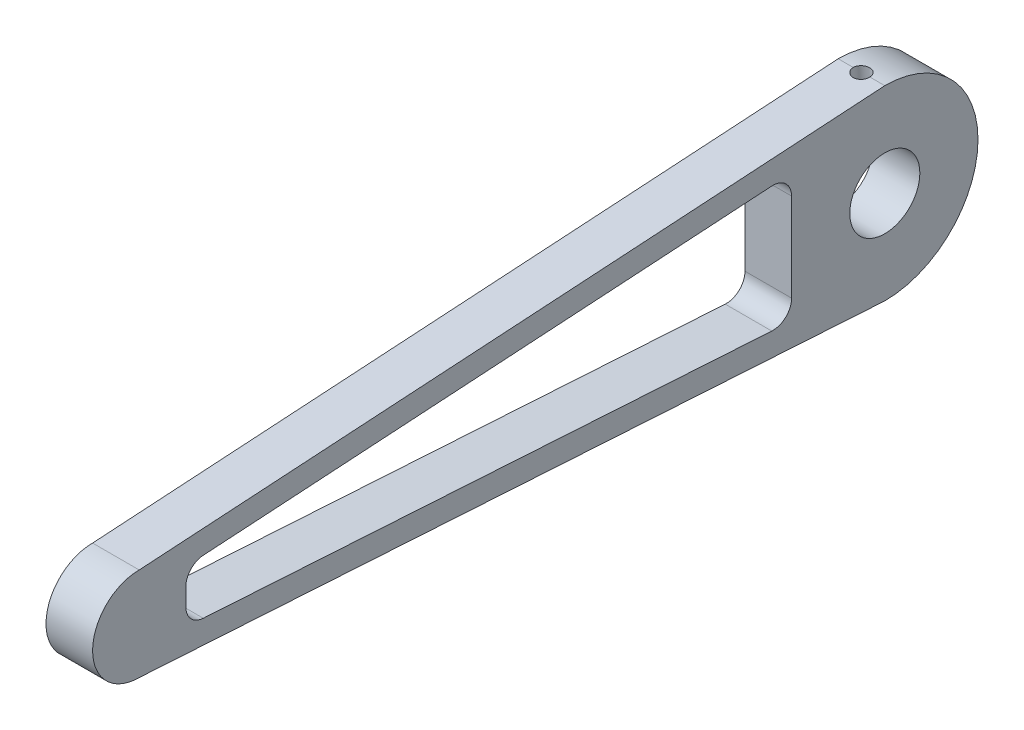
from build123d import *

# Parameters (mm, degrees)
SKETCH1_R                  = 4.7752
BOSS_EXTRUDE1_DEPTH        = 6.35
F_4_40_TAPPED_HOLE1_REACH  = 112.943
F_4_40_TAPPED_HOLE1_BORE_R = 1.1303


with BuildPart() as part:
    # Sketch1 → Boss-Extrude1 (new body)
    with BuildSketch(Plane(origin=(0, 0, 0), x_dir=(0, 0, -1), z_dir=(1, 0, 0))):
        with BuildLine():
            ThreePointArc((0, -12.7), (12.7, 0), (0, 12.7))
            Line((0, 12.7), (-1.581322957, 12.601167315))
            Line((-1.581322957, 12.601167315), (-101.6, 6.35))
            ThreePointArc((-101.6, 6.35), (-107.95, 0), (-101.6, -6.35))
            Line((-101.6, -6.35), (-1.581322957, -12.601167315))
            Line((-1.581322957, -12.601167315), (0, -12.7))
        make_face()
        with BuildLine():
            Line((-12.7, 6.02134877), (-12.7, -6.02134877))
            ThreePointArc((-12.7, -6.02134877), (-13.500867997, -7.872569955), (-15.398440847, -8.556402319))
            Line((-15.398440847, -8.556402319), (-92.868440847, -3.714527319))
            ThreePointArc((-92.868440847, -3.714527319), (-94.561221185, -2.918605773), (-95.25, -1.17947377))
            Line((-95.25, -1.17947377), (-95.25, 1.17947377))
            ThreePointArc((-95.25, 1.17947377), (-94.561221185, 2.918605773), (-92.868440847, 3.714527319))
            Line((-92.868440847, 3.714527319), (-15.398440847, 8.556402319))
            ThreePointArc((-15.398440847, 8.556402319), (-13.500867997, 7.872569955), (-12.7, 6.02134877))
        make_face(mode=Mode.SUBTRACT)
        Circle(SKETCH1_R, mode=Mode.SUBTRACT)
    extrude(amount=BOSS_EXTRUDE1_DEPTH)

    # #4-40 Tapped Hole1 bore (on position points) → #4-40 Tapped Hole1 (cut, up to next)
    with BuildSketch(Plane(origin=(3.175, 12.7, 0), x_dir=(0, -0.062378286155, 0.998052578483), z_dir=(0, 0.998052578483, 0.062378286155)), mode=Mode.PRIVATE) as f_4_40_tapped_hole1_sk1:
        Circle(F_4_40_TAPPED_HOLE1_BORE_R)
    f_4_40_tapped_hole1_tool1 = extrude(f_4_40_tapped_hole1_sk1.sketch, amount=-F_4_40_TAPPED_HOLE1_REACH, mode=Mode.PRIVATE) & part.part
    add(f_4_40_tapped_hole1_tool1.solids().sort_by_distance((3.175, 12.7, 0))[0], mode=Mode.SUBTRACT)


solid = part.part
